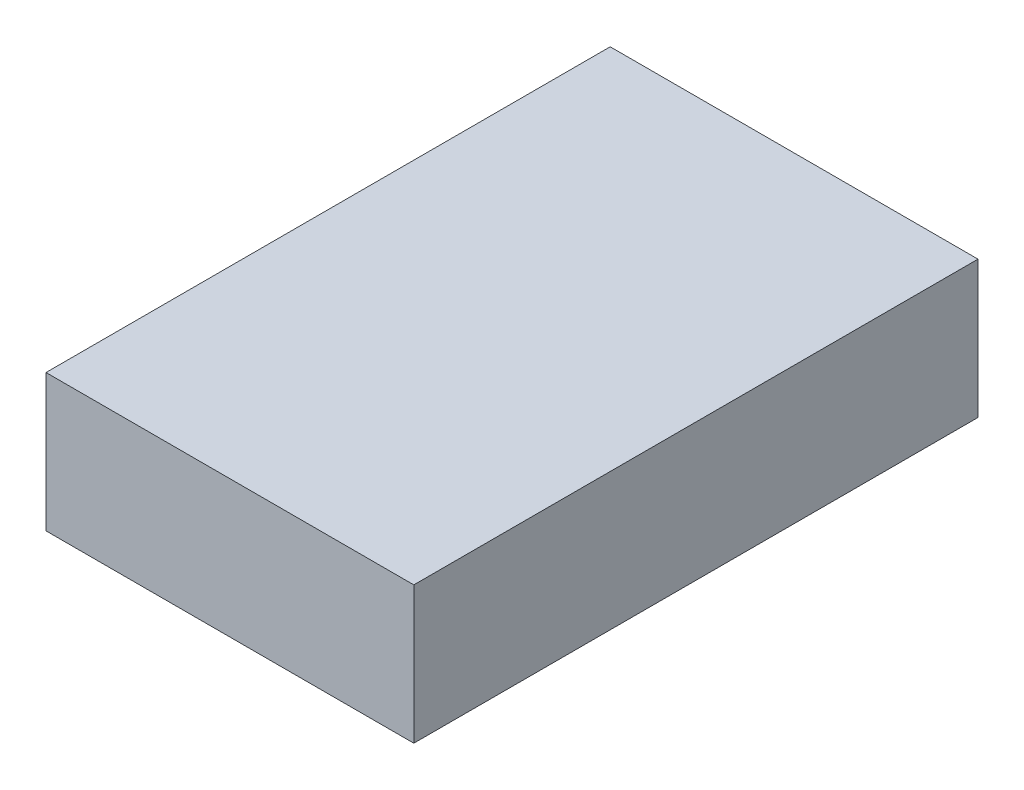
from build123d import *

# Parameters (mm, degrees)
SKETCH_1_W      = 59
SKETCH_1_H      = 22
EXTRUDE_1_DEPTH = 90.5


with BuildPart() as part:
    # 草圖1 → 填料-伸長1 (new body)
    with BuildSketch(Plane.XY):
        with Locations((-20.257572798, 37.592877493)):
            Rectangle(SKETCH_1_W, SKETCH_1_H)
    extrude(amount=EXTRUDE_1_DEPTH)


solid = part.part
